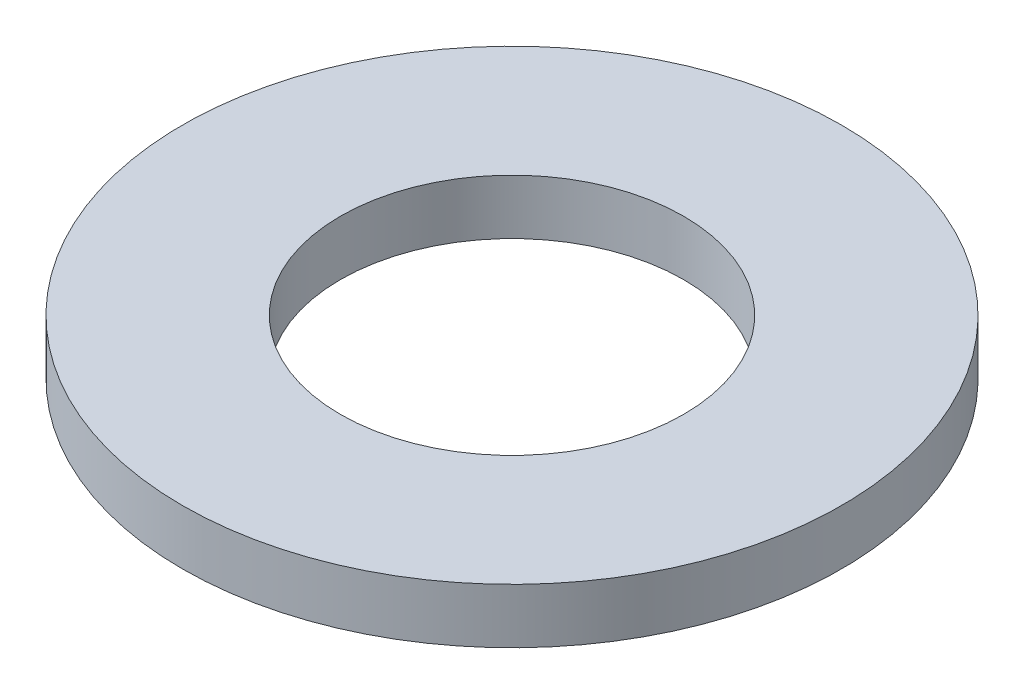
from build123d import *

# Parameters (mm, degrees)
SKETCH1_R           = 6
SKETCH1_R_2         = 3.125
BOSS_EXTRUDE1_DEPTH = 1


with BuildPart() as part:
    # Sketch1 → Boss-Extrude1 (new body)
    with BuildSketch(Plane(origin=(0, 0, 0), x_dir=(1, 0, 0), z_dir=(0, 1, 0))):
        with Locations(Location((0, 0, 0), (0, 0, 270))):
            Circle(SKETCH1_R)
        with Locations(Location((0, 0, 0), (0, 0, 270))):
            Circle(SKETCH1_R_2, mode=Mode.SUBTRACT)
    extrude(amount=BOSS_EXTRUDE1_DEPTH)


solid = part.part
